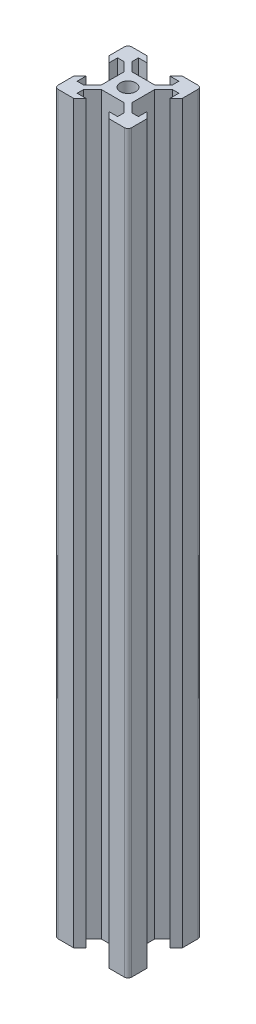
from build123d import *

# Parameters (mm, degrees)
MASTERLAYOUTSKETCH_R = 2.1
MAIN_EXTRUSION_DEPTH = 200
EDGE_FILLETS_R       = 1


with BuildPart() as part:
    # MasterLayoutSketch → Main Extrusion (new body)
    with BuildSketch(Plane(origin=(0, 0, 0), x_dir=(1, 0, 0), z_dir=(0, 1, 0))):
        Polygon((-8.325, 3.1), (-8.325, 5.5), (-6.560660172, 5.5), (-4.160660172, 3.1), (-4.160660172, -3.1), (-6.560660172, -5.5), (-8.325, -5.5), (-8.325, -3.1), (-10, -4.775), (-10, -10), (-4.775, -10), (-3.1, -8.325), (-5.5, -8.325), (-5.5, -6.560660172), (-3.1, -4.160660172), (3.1, -4.160660172), (5.5, -6.560660172), (5.5, -8.325), (3.1, -8.325), (4.775, -10), (10, -10), (10, -4.775), (8.325, -3.1), (8.325, -5.5), (6.560660172, -5.5), (4.160660172, -3.1), (4.160660172, 3.1), (6.560660172, 5.5), (8.325, 5.5), (8.325, 3.1), (10, 4.775), (10, 10), (4.775, 10), (3.1, 8.325), (5.5, 8.325), (5.5, 6.560660172), (3.1, 4.160660172), (-3.1, 4.160660172), (-5.5, 6.560660172), (-5.5, 8.325), (-3.1, 8.325), (-4.775, 10), (-10, 10), (-10, 4.775), align=None)
        with Locations(Location((0, 0, 0), (0, 0, 90))):
            Circle(MASTERLAYOUTSKETCH_R, mode=Mode.SUBTRACT)
    extrude(amount=MAIN_EXTRUSION_DEPTH)

    # Edge Fillets
    edge_fillets_edges = [part.edges().sort_by_distance(p)[0] for p in [
        (10, 100, -10),
        (10, 100, 10),
        (-10, 100, 10),
        (-10, 100, -10),
    ]]
    fillet(edge_fillets_edges, radius=EDGE_FILLETS_R)


solid = part.part
